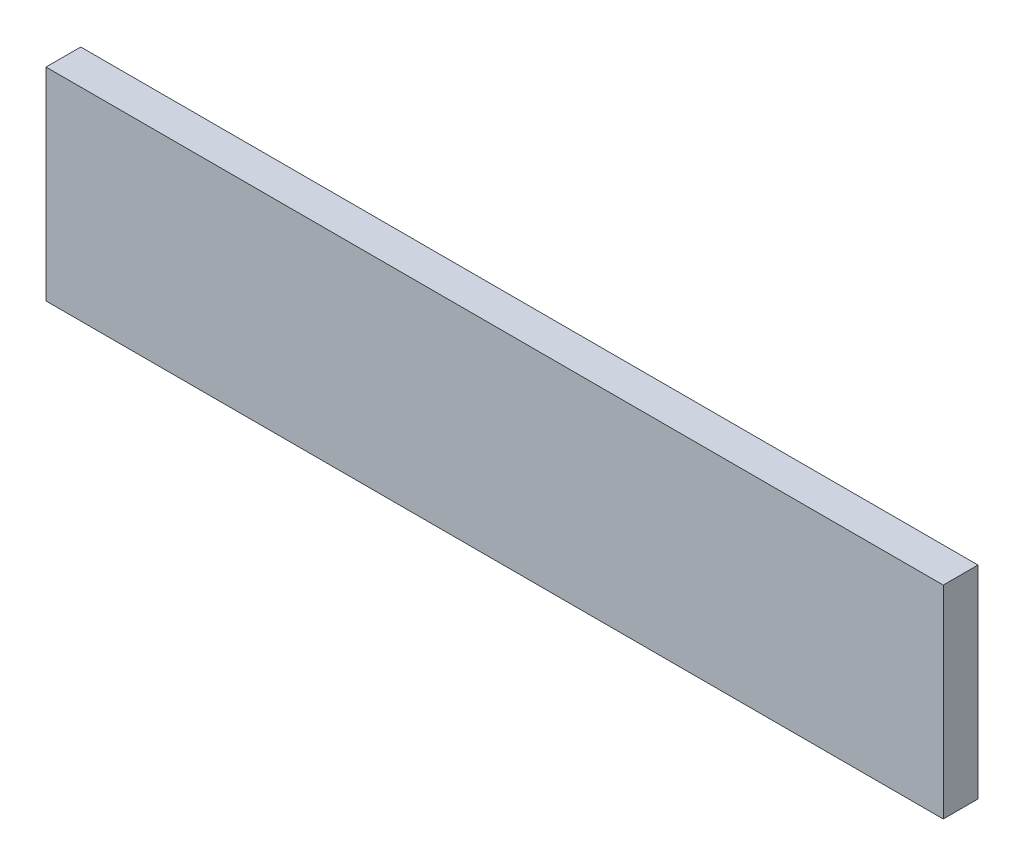
from build123d import *

# Parameters (mm, degrees)
SKETCH_1_W      = 310
SKETCH_1_H      = 70
EXTRUDE_1_DEPTH = 12


with BuildPart() as part:
    # 草图1 → 凸台-拉伸1 (new body)
    with BuildSketch(Plane.XY):
        with Locations((155, 35)):
            Rectangle(SKETCH_1_W, SKETCH_1_H)
    extrude(amount=EXTRUDE_1_DEPTH)


solid = part.part
